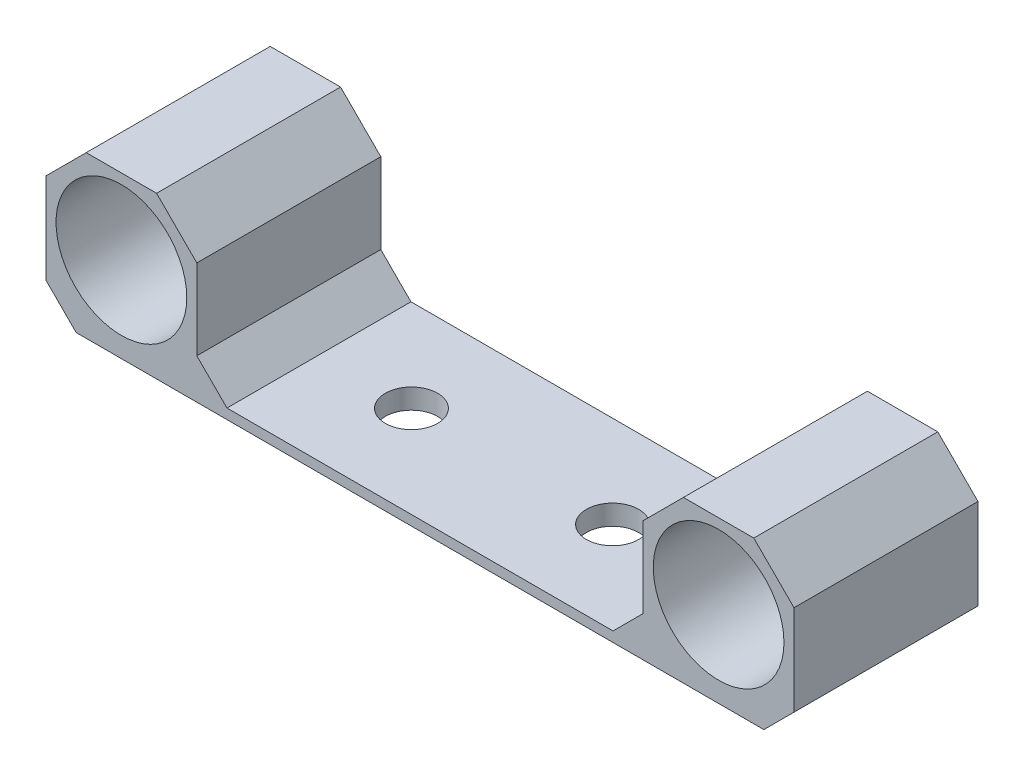
from build123d import *

# Parameters (mm, degrees)
SKETCH1_W           = 15
SKETCH1_H           = 18.3
SKETCH1_W_2         = 44.4
SKETCH1_R           = 2.6
BOSS_EXTRUDE1_DEPTH = 2
SKETCH1_3_W         = 15
SKETCH1_3_H         = 18.3
BOSS_EXTRUDE2_DEPTH = 17
SKETCH2_R           = 6.5
CUT_EXTRUDE2_DEPTH  = 12.315
FILLET3_SIZE        = 4
FILLET4_SIZE        = 3
CHAMFER2_SIZE       = 1


with BuildPart() as part:
    # Sketch1 → Boss-Extrude1 (new body)
    # profile 1 of 3: a face of its own
    with BuildSketch(Plane(origin=(0, 0, 0), x_dir=(1, 0, 0), z_dir=(0, 1, 0))):
        with Locations((-7.5, 9.15)):
            Rectangle(SKETCH1_W, SKETCH1_H)
    # profile 2 of 3: a face of its own
    with BuildSketch(Plane(origin=(0, 0, 0), x_dir=(1, 0, 0), z_dir=(0, 1, 0))):
        with Locations((22.2, 9.15)):
            Rectangle(SKETCH1_W_2, SKETCH1_H)
        with Locations(Location((32.2, 9.15, 0), (0, 0, 270))):
            Circle(SKETCH1_R, mode=Mode.SUBTRACT)
        with Locations(Location((12.2, 9.15, 0), (0, 0, 270))):
            Circle(SKETCH1_R, mode=Mode.SUBTRACT)
    # profile 3 of 3: a face of its own
    with BuildSketch(Plane(origin=(0, 0, 0), x_dir=(1, 0, 0), z_dir=(0, 1, 0))):
        with Locations((51.9, 9.15)):
            Rectangle(SKETCH1_W, SKETCH1_H)
    extrude(amount=BOSS_EXTRUDE1_DEPTH)

    # Sketch1<3> → Boss-Extrude2 (add)
    with BuildSketch(Plane(origin=(0, 0, 0), x_dir=(1, 0, 0), z_dir=(0, 1, 0))):
        with Locations((51.9, 9.15)):
            Rectangle(SKETCH1_3_W, SKETCH1_3_H)
        with Locations((-7.5, 9.15)):
            Rectangle(SKETCH1_3_W, SKETCH1_3_H)
    extrude(amount=BOSS_EXTRUDE2_DEPTH)

    # Sketch2 → Cut-Extrude2 (cut)
    with BuildSketch(Plane.XY):
        with Locations((-7.5, 9.5)):
            Circle(SKETCH2_R)
        with Locations((51.9, 9.5)):
            Circle(SKETCH2_R)
    extrude(amount=-CUT_EXTRUDE2_DEPTH, mode=Mode.SUBTRACT)

    # Fillet3
    fillet3_edges = [part.edges().sort_by_distance(p)[0] for p in [
        (59.4, 0, -9.15),
        (-15, 0, -9.15),
        (44.4, 17, -9.15),
        (59.4, 17, -9.15),
        (-15, 17, -9.15),
        (0, 17, -9.15),
    ]]
    chamfer(fillet3_edges, length=FILLET3_SIZE)

    # Fillet4
    fillet4_edges = [part.edges().sort_by_distance(p)[0] for p in [
        (44.4, 2, -9.15),
        (0, 2, -9.15),
    ]]
    chamfer(fillet4_edges, length=FILLET4_SIZE)

    # Chamfer2
    chamfer2_edges = [part.edges().sort_by_distance(p)[0] for p in [
        (22.2, 0, -18.3),
        (22.2, 0, 0),
    ]]
    chamfer(chamfer2_edges, length=CHAMFER2_SIZE)


solid = part.part
